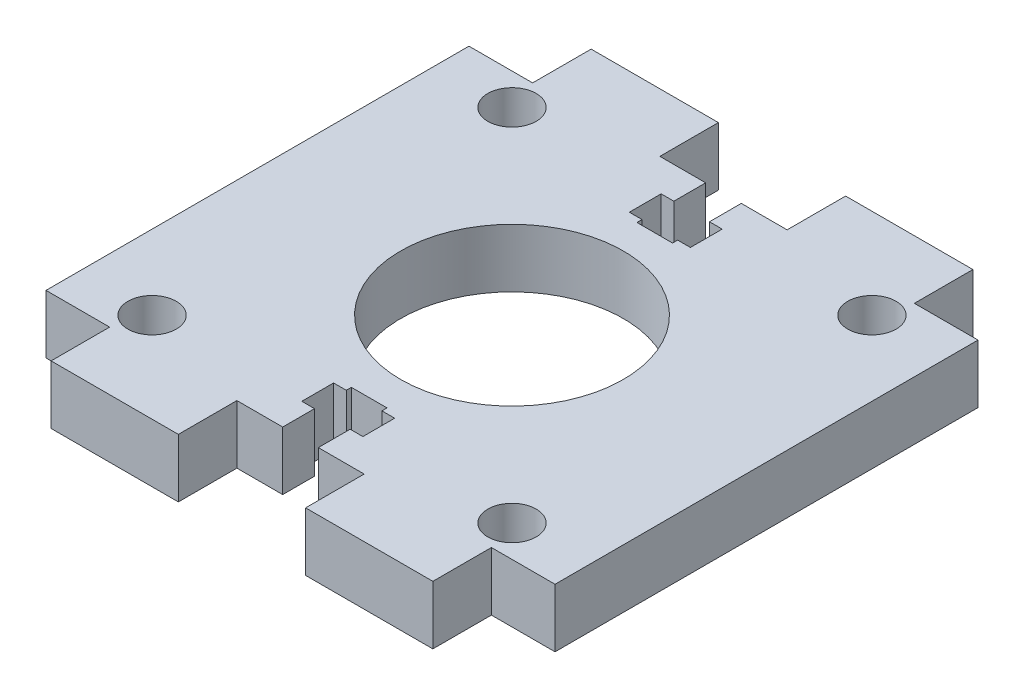
from build123d import *

# Parameters (mm, degrees)
SKETCH1_R           = 11.1125
SKETCH1_R_2         = 2.413
BOSS_EXTRUDE1_DEPTH = 5.842


with BuildPart() as part:
    # Sketch1 → Boss-Extrude1 (new body)
    with BuildSketch(Plane(origin=(0, 0, 0), x_dir=(1, 0, 0), z_dir=(0, 1, 0))):
        Polygon((25.4, -21.1058), (19.05, -21.1058), (19.05, -26.9478), (6.35, -26.9478), (6.35, -21.1058), (1.778, -21.1058), (1.778, -17.9308), (3.048, -17.9308), (3.048, -14.7558), (1.778, -14.7558), (1.778, -14.2478), (-1.778, -14.2478), (-1.778, -14.7558), (-3.048, -14.7558), (-3.048, -17.9308), (-1.778, -17.9308), (-1.778, -21.1058), (-6.35, -21.1058), (-6.35, -26.9478), (-19.05, -26.9478), (-19.05, -21.1058), (-25.4, -21.1058), (-25.4, 21.1058), (-19.05, 21.1058), (-19.05, 26.9478), (-6.35, 26.9478), (-6.35, 21.1058), (-1.778, 21.1058), (-1.778, 17.9308), (-3.048, 17.9308), (-3.048, 14.7558), (-1.778, 14.7558), (-1.778, 14.2478), (1.778, 14.2478), (1.778, 14.7558), (3.048, 14.7558), (3.048, 17.9308), (1.778, 17.9308), (1.778, 21.1058), (6.35, 21.1058), (6.35, 26.9478), (19.05, 26.9478), (19.05, 21.1058), (25.4, 21.1058), align=None)
        with Locations(Location((0, 0, 0), (0, 0, 270))):
            Circle(SKETCH1_R, mode=Mode.SUBTRACT)
        with Locations(Location((-17.960512242, 17.960512242, 0), (0, 0, 270))):
            Circle(SKETCH1_R_2, mode=Mode.SUBTRACT)
        with Locations(Location((17.960512242, 17.960512242, 0), (0, 0, 270))):
            Circle(SKETCH1_R_2, mode=Mode.SUBTRACT)
        with Locations(Location((17.960512242, -17.960512242, 0), (0, 0, 270))):
            Circle(SKETCH1_R_2, mode=Mode.SUBTRACT)
        with Locations(Location((-17.960512242, -17.960512242, 0), (0, 0, 270))):
            Circle(SKETCH1_R_2, mode=Mode.SUBTRACT)
    extrude(amount=BOSS_EXTRUDE1_DEPTH)


solid = part.part
